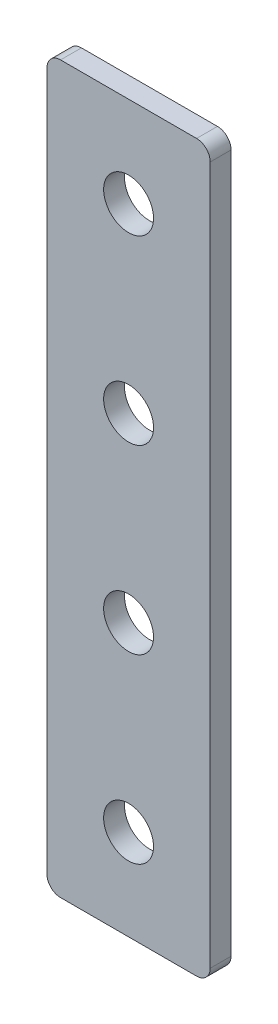
from build123d import *

# Parameters (mm, degrees)
SKETCH1_R           = 2.75
BOSS_EXTRUDE1_DEPTH = 2.3


with BuildPart() as part:
    # Sketch1 → Boss-Extrude1 (new body)
    with BuildSketch(Plane.XY):
        with BuildLine():
            Line((-7.5, 0), (7.5, 0))
            ThreePointArc((7.5, 0), (8.560660172, 0.439339828), (9, 1.5))
            Line((9, 1.5), (9, 78.5))
            ThreePointArc((9, 78.5), (8.560660172, 79.560660172), (7.5, 80))
            Line((7.5, 80), (-7.5, 80))
            ThreePointArc((-7.5, 80), (-8.560660172, 79.560660172), (-9, 78.5))
            Line((-9, 78.5), (-9, 1.5))
            ThreePointArc((-9, 1.5), (-8.560660172, 0.439339828), (-7.5, 0))
        make_face()
        with Locations((0, 70)):
            Circle(SKETCH1_R, mode=Mode.SUBTRACT)
        with Locations((0, 50)):
            Circle(SKETCH1_R, mode=Mode.SUBTRACT)
        with Locations((0, 30)):
            Circle(SKETCH1_R, mode=Mode.SUBTRACT)
        with Locations((0, 10)):
            Circle(SKETCH1_R, mode=Mode.SUBTRACT)
    extrude(amount=-BOSS_EXTRUDE1_DEPTH)


solid = part.part
